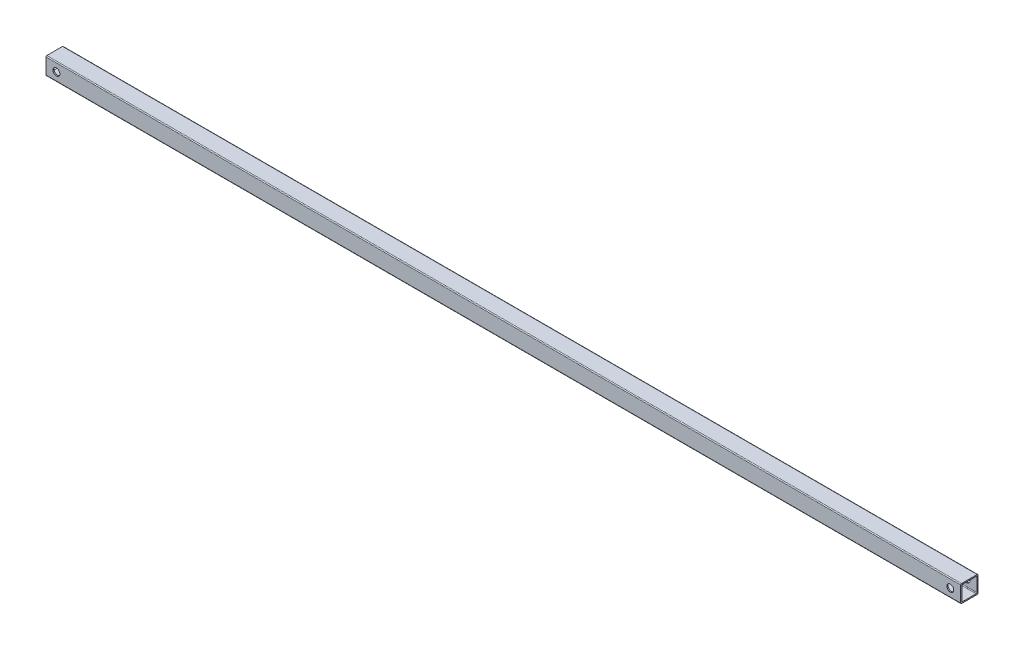
from build123d import *

# Parameters (mm, degrees)
BOSS_EXTRUDE1_DEPTH      = 838.2
BOSS_EXTRUDE1_DEPTH_BACK = 838.2
SKETCH5_R                = 6.35
CUT_EXTRUDE1_DEPTH       = 839.951320474


with BuildPart() as part:
    # Sketch4 → Boss-Extrude1 (new, two sides: drawn at the far end of the back side and taken through both)
    with BuildSketch(Plane(origin=(0, 0, 0), x_dir=(0, 0, -1), z_dir=(1, 0, 0)).offset(-BOSS_EXTRUDE1_DEPTH_BACK)):
        with BuildLine():
            Line((15.875, -14.2875), (15.875, 14.2875))
            ThreePointArc((15.875, 14.2875), (15.410032015, 15.410032015), (14.2875, 15.875))
            Line((14.2875, 15.875), (-14.2875, 15.875))
            ThreePointArc((-14.2875, 15.875), (-15.410032015, 15.410032015), (-15.875, 14.2875))
            Line((-15.875, 14.2875), (-15.875, -14.2875))
            ThreePointArc((-15.875, -14.2875), (-15.410032015, -15.410032015), (-14.2875, -15.875))
            Line((-14.2875, -15.875), (14.2875, -15.875))
            ThreePointArc((14.2875, -15.875), (15.410032015, -15.410032015), (15.875, -14.2875))
        make_face()
        with BuildLine():
            Line((13.7668, 12.39012), (13.7668, -12.39012))
            ThreePointArc((13.7668, -12.39012), (13.363579764, -13.363579764), (12.39012, -13.7668))
            Line((12.39012, -13.7668), (-12.39012, -13.7668))
            ThreePointArc((-12.39012, -13.7668), (-13.363579764, -13.363579764), (-13.7668, -12.39012))
            Line((-13.7668, -12.39012), (-13.7668, 12.39012))
            ThreePointArc((-13.7668, 12.39012), (-13.363579764, 13.363579764), (-12.39012, 13.7668))
            Line((-12.39012, 13.7668), (12.39012, 13.7668))
            ThreePointArc((12.39012, 13.7668), (13.363579764, 13.363579764), (13.7668, 12.39012))
        make_face(mode=Mode.SUBTRACT)
    extrude(amount=BOSS_EXTRUDE1_DEPTH + BOSS_EXTRUDE1_DEPTH_BACK)

    # Sketch5 → Cut-Extrude1 (cut, through all)
    with BuildSketch(Plane.XY.offset(15.875)):
        with Locations((819.15, 0)):
            Circle(SKETCH5_R)
        with Locations((-819.15, 0)):
            Circle(SKETCH5_R)
    extrude(amount=-CUT_EXTRUDE1_DEPTH, mode=Mode.SUBTRACT)


solid = part.part
